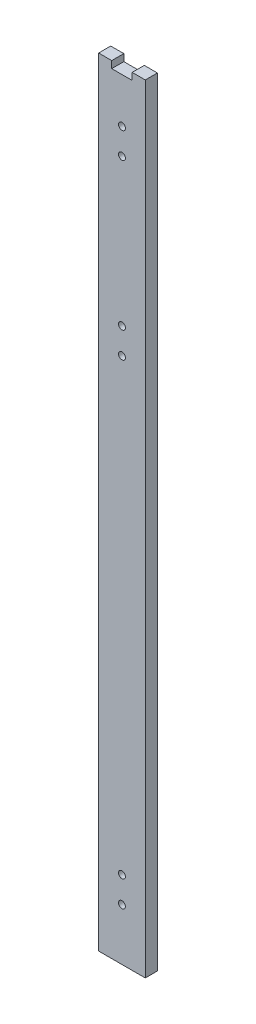
from build123d import *

# Parameters (mm, degrees)
SKETCH_1_W          = 27
SKETCH_1_H          = 7
EXTRUDE_1_DEPTH     = 450
SKETCH_2_W          = 11.82792619
SKETCH_2_H          = 8.082032634
CUT_EXTRUDE_1_DEPTH = 451.25687113
SKETCH_3_R          = 2
CUT_EXTRUDE_2_DEPTH = 451.25687113


with BuildPart() as part:
    # 草图1 → 凸台-拉伸1 (new body)
    with BuildSketch(Plane(origin=(0, 0, 0), x_dir=(1, 0, 0), z_dir=(0, 1, 0))):
        Rectangle(SKETCH_1_W, SKETCH_1_H)
    extrude(amount=EXTRUDE_1_DEPTH)

    # 草图2 → 切除-拉伸1 (cut, through all)
    with BuildSketch(Plane(origin=(0, 0, -3.5), x_dir=(-1, 0, 0), z_dir=(0, 0, -1))):
        with Locations((0, 450)):
            Rectangle(SKETCH_2_W, SKETCH_2_H)
    extrude(amount=-CUT_EXTRUDE_1_DEPTH, mode=Mode.SUBTRACT)

    # 草图3 → 切除-拉伸2 (cut, through all)
    with BuildSketch(Plane(origin=(0, 0, -3.5), x_dir=(-1, 0, 0), z_dir=(0, 0, -1))):
        with Locations((0, 420)):
            Circle(SKETCH_3_R)
        with Locations((0, 405)):
            Circle(SKETCH_3_R)
        with Locations((0, 320)):
            Circle(SKETCH_3_R)
        with Locations((0, 305)):
            Circle(SKETCH_3_R)
        with Locations((0, 30)):
            Circle(SKETCH_3_R)
        with Locations((0, 45)):
            Circle(SKETCH_3_R)
    extrude(amount=-CUT_EXTRUDE_2_DEPTH, mode=Mode.SUBTRACT)


solid = part.part
